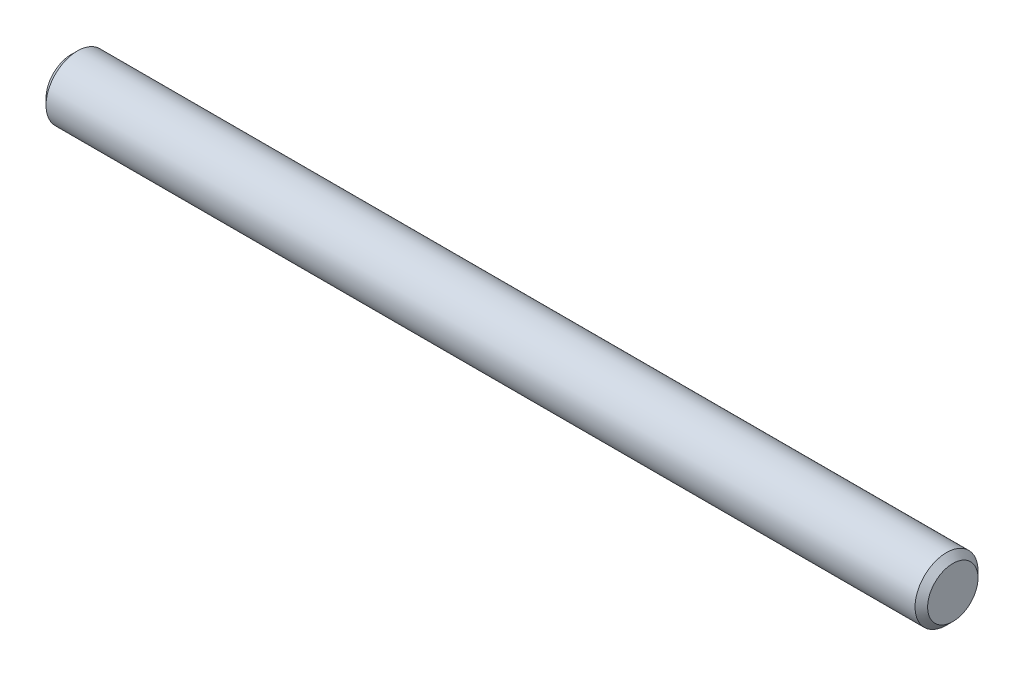
from build123d import *

# Parameters (mm, degrees)
EXTRUDE1_DEPTH      = 11.1125
EXTRUDE1_DEPTH_BACK = 11.1125
SKETCH2_R           = 0.79375
CHAMFER1_SIZE       = 0.15875


with BuildPart() as part:
    # Sketch2 → Extrude1 (new, two sides: drawn at the far end of the back side and taken through both)
    with BuildSketch(Plane(origin=(0, 0, 0), x_dir=(0, 0, -1), z_dir=(1, 0, 0)).offset(-EXTRUDE1_DEPTH_BACK)):
        Circle(SKETCH2_R)
    extrude(amount=EXTRUDE1_DEPTH + EXTRUDE1_DEPTH_BACK)

    # Chamfer1
    chamfer1_edges = [part.edges().sort_by_distance(p)[0] for p in [
        (-11.1125, 0, 0.79375),
        (11.1125, 0, 0.79375),
    ]]
    chamfer(chamfer1_edges, length=CHAMFER1_SIZE)


solid = part.part
